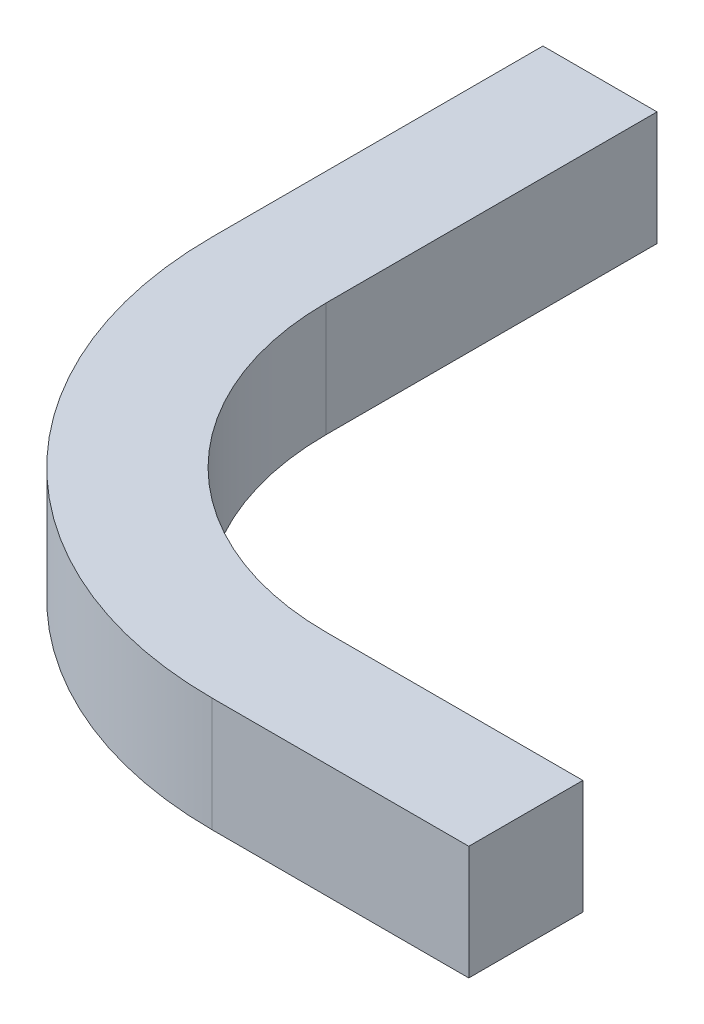
from build123d import *

# Parameters (mm, degrees)
BOSS_EXTRUDE1_DEPTH = 20


with BuildPart() as part:
    # Sketch1 → Boss-Extrude1 (new body)
    with BuildSketch(Plane(origin=(0, 0, 0), x_dir=(1, 0, 0), z_dir=(0, 1, 0))):
        with BuildLine():
            Line((0, 10), (0, -10))
            Line((0, -10), (-45, -10))
            ThreePointArc((-45, -10), (-94.497474683, 10.502525317), (-115, 60))
            Line((-115, 60), (-115, 118))
            Line((-115, 118), (-95, 118))
            Line((-95, 118), (-95, 60))
            ThreePointArc((-95, 60), (-80.355339059, 24.644660941), (-45, 10))
            Line((-45, 10), (0, 10))
        make_face()
    extrude(amount=BOSS_EXTRUDE1_DEPTH)


solid = part.part
